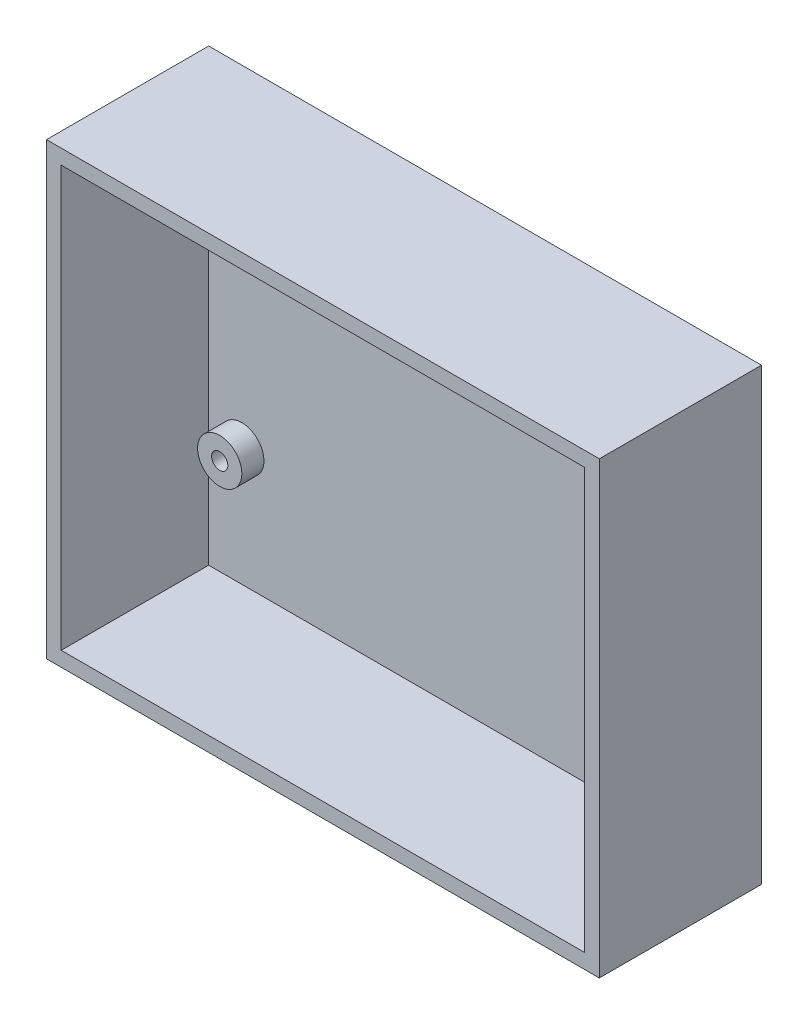
from build123d import *

# Parameters (mm, degrees)
SKETCH_1_W          = 75
SKETCH_1_H          = 61
EXTRUDE_1_DEPTH     = 22
SKETCH_2_W          = 71
SKETCH_2_H          = 57
CUT_EXTRUDE_1_DEPTH = 100.146356464
SKETCH_3_W          = 75
SKETCH_3_H          = 61
EXTRUDE_2_DEPTH     = 2
SKETCH_4_R          = 3
EXTRUDE_3_DEPTH     = 5
SKETCH_5_R          = 1.1
CUT_EXTRUDE_2_DEPTH = 100.146356464


with BuildPart() as part:
    # 草图1 → 凸台-拉伸1 (new body)
    with BuildSketch(Plane.XY):
        with Locations((37.5, 30.5)):
            Rectangle(SKETCH_1_W, SKETCH_1_H)
    extrude(amount=EXTRUDE_1_DEPTH)

    # 草图2 → 切除-拉伸1 (cut, through all)
    with BuildSketch(Plane.XY):
        with Locations((37.5, 30.5)):
            Rectangle(SKETCH_2_W, SKETCH_2_H)
    extrude(amount=CUT_EXTRUDE_1_DEPTH, mode=Mode.SUBTRACT)

    # 草图3 → 凸台-拉伸2 (add)
    with BuildSketch(Plane.XY):
        with Locations((37.5, 30.5)):
            Rectangle(SKETCH_3_W, SKETCH_3_H)
    extrude(amount=EXTRUDE_2_DEPTH)

    # 草图4 → 凸台-拉伸3 (add)
    with BuildSketch(Plane.XY):
        with Locations(Location((6.5, 18, 0), (0, 0, 180))):
            Circle(SKETCH_4_R)
        with Locations(Location((68.5, 18, 0), (0, 0, 180))):
            Circle(SKETCH_4_R)
        with Locations(Location((6.5, 54, 0), (0, 0, 180))):
            Circle(SKETCH_4_R)
        with Locations(Location((68.5, 54, 0), (0, 0, 180))):
            Circle(SKETCH_4_R)
    extrude(amount=EXTRUDE_3_DEPTH)

    # 草图5 → 切除-拉伸2 (cut, through all)
    with BuildSketch(Plane.XY):
        with Locations((6.5, 18)):
            Circle(SKETCH_5_R)
        with Locations((68.5, 18)):
            Circle(SKETCH_5_R)
        with Locations((6.5, 54)):
            Circle(SKETCH_5_R)
        with Locations((68.5, 54)):
            Circle(SKETCH_5_R)
    extrude(amount=CUT_EXTRUDE_2_DEPTH, mode=Mode.SUBTRACT)


solid = part.part
